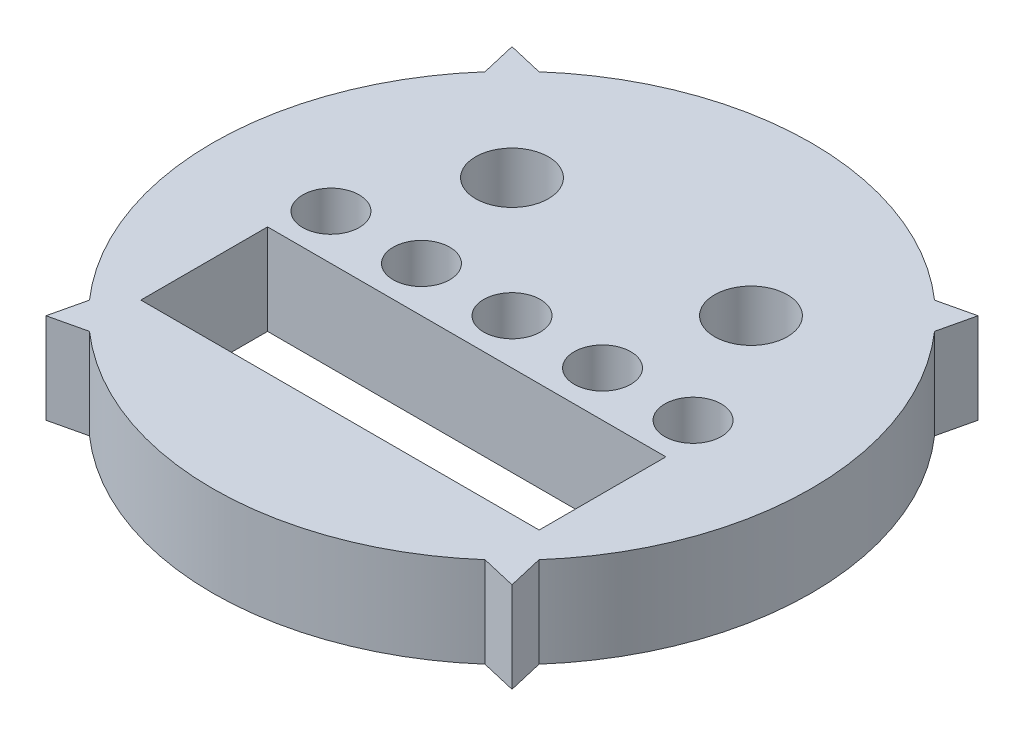
from build123d import *

# Parameters (mm, degrees)
SKETCH1_R           = 1.984375
SKETCH1_R_2         = 2.5527
SKETCH1_W           = 27.94
SKETCH1_H           = 8.89
BOSS_EXTRUDE1_DEPTH = 6.35


with BuildPart() as part:
    # Sketch1 → Boss-Extrude1 (new body)
    with BuildSketch(Plane(origin=(0, 0, 0), x_dir=(1, 0, 0), z_dir=(0, 1, 0))):
        with BuildLine():
            Line((13.870085237, 15.767711804), (16.343875029, 16.343875029))
            Line((16.343875029, 16.343875029), (15.767711804, 13.870085237))
            ThreePointArc((15.767711804, 13.870085237), (21, 0), (15.767711804, -13.870085237))
            Line((15.767711804, -13.870085237), (16.343875029, -16.343875029))
            Line((16.343875029, -16.343875029), (13.870085237, -15.767711804))
            ThreePointArc((13.870085237, -15.767711804), (0, -21), (-13.870085237, -15.767711804))
            Line((-13.870085237, -15.767711804), (-16.343875029, -16.343875029))
            Line((-16.343875029, -16.343875029), (-15.767711804, -13.870085237))
            ThreePointArc((-15.767711804, -13.870085237), (-21, 0), (-15.767711804, 13.870085237))
            Line((-15.767711804, 13.870085237), (-16.343875029, 16.343875029))
            Line((-16.343875029, 16.343875029), (-13.870085237, 15.767711804))
            ThreePointArc((-13.870085237, 15.767711804), (0, 21), (13.870085237, 15.767711804))
        make_face()
        with Locations(Location((-12.7, 0, 0), (0, 0, 270))):
            Circle(SKETCH1_R, mode=Mode.SUBTRACT)
        with Locations(Location((-6.35, 0, 0), (0, 0, 270))):
            Circle(SKETCH1_R, mode=Mode.SUBTRACT)
        with Locations(Location((0, 0, 0), (0, 0, 270))):
            Circle(SKETCH1_R, mode=Mode.SUBTRACT)
        with Locations(Location((-8.382, 8.382, 0), (0, 0, 270))):
            Circle(SKETCH1_R_2, mode=Mode.SUBTRACT)
        with Locations(Location((8.382, 8.382, 0), (0, 0, 270))):
            Circle(SKETCH1_R_2, mode=Mode.SUBTRACT)
        with Locations(Location((6.35, 0, 0), (0, 0, 270))):
            Circle(SKETCH1_R, mode=Mode.SUBTRACT)
        with Locations(Location((12.7, 0, 0), (0, 0, 270))):
            Circle(SKETCH1_R, mode=Mode.SUBTRACT)
        with Locations((0, -7.62)):
            Rectangle(SKETCH1_W, SKETCH1_H, mode=Mode.SUBTRACT)
    extrude(amount=BOSS_EXTRUDE1_DEPTH)


solid = part.part
